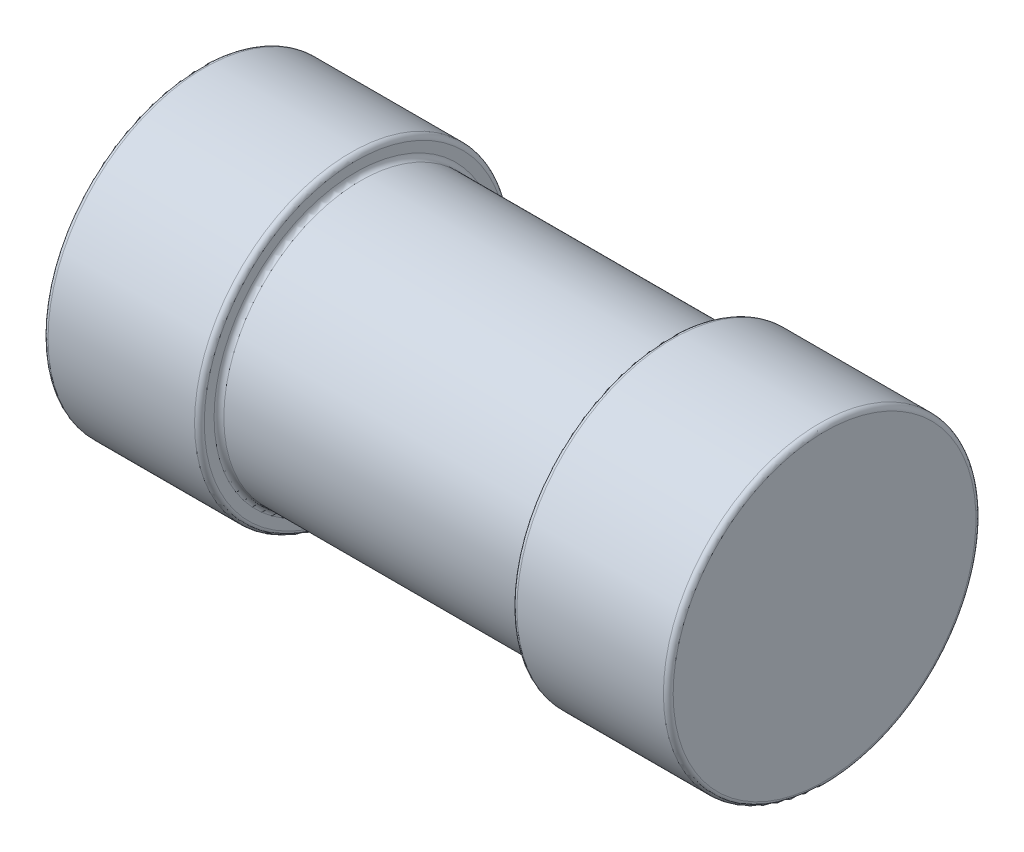
from build123d import *


with BuildPart() as part:
    # 草图1 → 旋转3 (revolve)
    with BuildSketch(Plane.XY, mode=Mode.PRIVATE) as revolve_3_sk:
        with BuildLine():
            Line((-2.043313513, -3.968536382), (-1.293313513, -3.968536382))
            ThreePointArc((-1.293313513, -3.968536382), (-1.275635844, -3.975858712), (-1.268313513, -3.993536382))
            Line((-1.268313513, -3.993536382), (-1.268313513, -4.043536382))
            ThreePointArc((-1.268313513, -4.043536382), (-1.260991183, -4.061214051), (-1.243313513, -4.068536382))
            Line((-1.243313513, -4.068536382), (0.306686487, -4.068536382))
            ThreePointArc((0.306686487, -4.068536382), (0.324364156, -4.061214051), (0.331686487, -4.043536382))
            Line((0.331686487, -4.043536382), (0.331686487, -3.993536382))
            ThreePointArc((0.331686487, -3.993536382), (0.339008817, -3.975858712), (0.356686487, -3.968536382))
            Line((0.356686487, -3.968536382), (1.106686487, -3.968536382))
            ThreePointArc((1.106686487, -3.968536382), (1.124364156, -3.975858712), (1.131686487, -3.993536382))
            Line((1.131686487, -3.993536382), (1.131686487, -4.768536382))
            Line((1.131686487, -4.768536382), (-2.068313513, -4.768536382))
            Line((-2.068313513, -4.768536382), (-2.068313513, -3.993536382))
            ThreePointArc((-2.068313513, -3.993536382), (-2.060991183, -3.975858712), (-2.043313513, -3.968536382))
        make_face()
    revolve(revolve_3_sk.sketch.rotate(Axis((-2.068313513, -4.768536382, 0), (1, 0, 0)), 90), axis=Axis((-2.068313513, -4.768536382, 0), (1, 0, 0)))


solid = part.part
